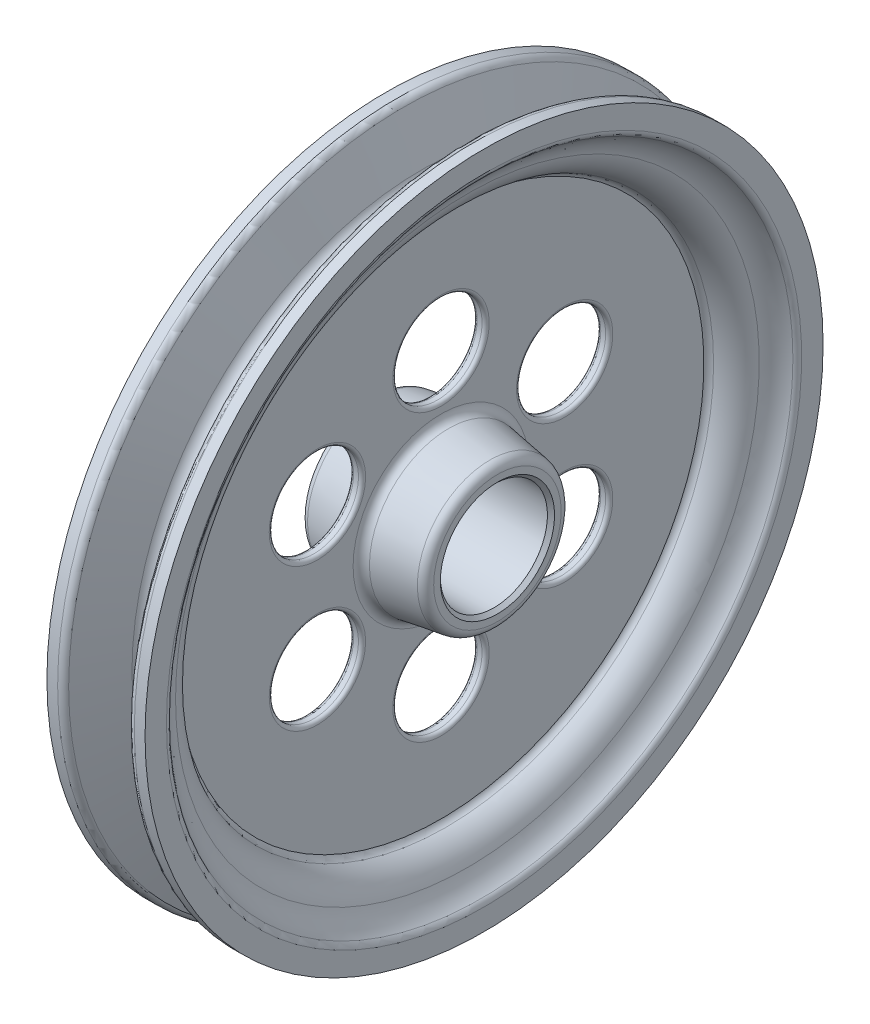
from build123d import *

# Parameters (mm, degrees)
SKETCH2_R          = 25
CUT_EXTRUDE2_DEPTH = 5
FILLET1_R          = 2


with BuildPart() as part:
    # Sketch1 → Revolve1 (revolve)
    with BuildSketch(Plane.XY, mode=Mode.PRIVATE) as revolve1_sk:
        with BuildLine():
            Line((33, 30), (-33, 30))
            Line((-33, 30), (-35, 32))
            Line((-35, 32), (-35, 35.728408331))
            ThreePointArc((-35, 35.728408331), (-33.801583634, 38.976170927), (-30.780815249, 40.667064783))
            Line((-30.780815249, 40.667064783), (-7.594184751, 44.332935217))
            ThreePointArc((-7.594184751, 44.332935217), (-4.573416366, 46.023829073), (-3.375, 49.271591669))
            Line((-3.375, 49.271591669), (-3.375, 147.32252083))
            ThreePointArc((-3.375, 147.32252083), (-4.48700212, 148.93708643), (-6.13429855, 150))
            ThreePointArc((-6.13429855, 150), (-13.763626274, 155.33989583), (-18.147877074, 163.555702176))
            ThreePointArc((-18.147877074, 163.555702176), (-21.011355907, 169.825625769), (-25.833333333, 174.751068552))
            ThreePointArc((-25.833333333, 174.751068552), (-27.059026084, 176.174258142), (-27.5, 178))
            Line((-27.5, 178), (-27.5, 190))
            Line((-27.5, 190), (-21.480084432, 190))
            ThreePointArc((-21.480084432, 190), (-19.2578035, 189.325878449), (-17.784566302, 187.530733729))
            Line((-17.784566302, 187.530733729), (-7.39103626, 162.438532541))
            ThreePointArc((-7.39103626, 162.438532541), (0, 157.5), (7.39103626, 162.438532541))
            Line((7.39103626, 162.438532541), (17.784566302, 187.530733729))
            ThreePointArc((17.784566302, 187.530733729), (19.2578035, 189.325878449), (21.480084432, 190))
            Line((21.480084432, 190), (27.5, 190))
            Line((27.5, 190), (27.5, 178))
            ThreePointArc((27.5, 178), (27.059026084, 176.174258142), (25.833333333, 174.751068552))
            ThreePointArc((25.833333333, 174.751068552), (21.011355907, 169.825625769), (18.147877074, 163.555702176))
            ThreePointArc((18.147877074, 163.555702176), (13.763626274, 155.33989583), (6.13429855, 150))
            ThreePointArc((6.13429855, 150), (4.48700212, 148.93708643), (3.375, 147.32252083))
            Line((3.375, 147.32252083), (3.375, 49.271591669))
            ThreePointArc((3.375, 49.271591669), (4.573416366, 46.023829073), (7.594184751, 44.332935217))
            Line((7.594184751, 44.332935217), (30.780815249, 40.667064783))
            ThreePointArc((30.780815249, 40.667064783), (33.801583634, 38.976170927), (35, 35.728408331))
            Line((35, 35.728408331), (35, 32))
            Line((35, 32), (33, 30))
        make_face()
    revolve(revolve1_sk.sketch.rotate(Axis((-94.450860502, 0, 0), (1, 0, 0)), 90), axis=Axis((-94.450860502, 0, 0), (1, 0, 0)))

    # Sketch2 → Cut-Extrude2 (cut, symmetric)
    with BuildSketch(Plane(origin=(0, 0, 0), x_dir=(0, 0, -1), z_dir=(1, 0, 0))):
        with Locations(Location((0, 80, 0), (0, 0, 180))):
            Circle(SKETCH2_R)
        with Locations(Location((69.282032303, 40, 0), (0, 0, 180))):
            Circle(SKETCH2_R)
        with Locations(Location((69.282032303, -40, 0), (0, 0, 180))):
            Circle(SKETCH2_R)
        with Locations(Location((0, -80, 0), (0, 0, 180))):
            Circle(SKETCH2_R)
        with Locations(Location((-69.282032303, -40, 0), (0, 0, 180))):
            Circle(SKETCH2_R)
        with Locations(Location((-69.282032303, 40, 0), (0, 0, 180))):
            Circle(SKETCH2_R)
    extrude(amount=CUT_EXTRUDE2_DEPTH, both=True, mode=Mode.SUBTRACT)

    # Fillet1
    fillet1_edges = [part.edges().sort_by_distance(p)[0] for p in [
        (3.375, 80, -25),
        (-3.375, 80, -25),
        (3.375, 40, -94.282032303),
        (-3.375, 40, -94.282032303),
        (3.375, -40, -94.282032303),
        (-3.375, -40, -94.282032303),
        (3.375, -80, -25),
        (-3.375, -80, -25),
        (3.375, -40, 44.282032303),
        (-3.375, -40, 44.282032303),
        (3.375, 40, 44.282032303),
        (-3.375, 40, 44.282032303),
    ]]
    fillet(fillet1_edges, radius=FILLET1_R)


solid = part.part
